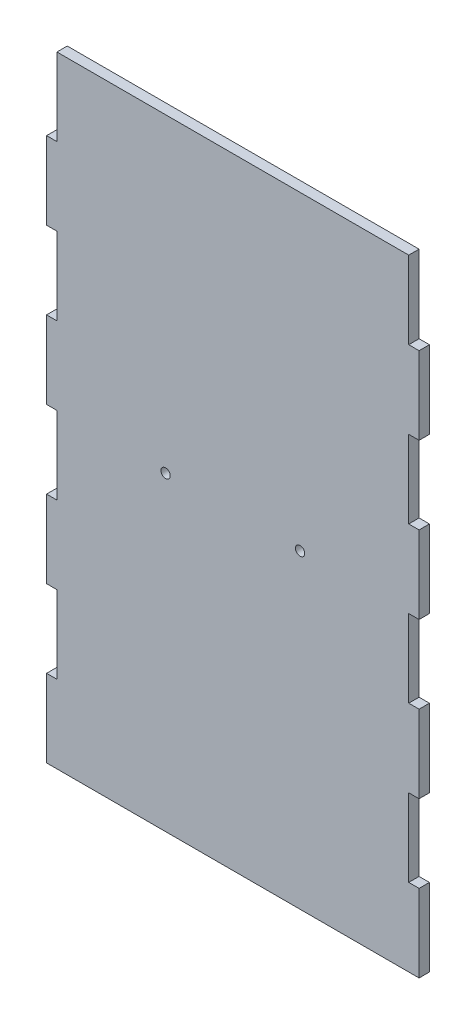
from build123d import *

# Parameters (mm, degrees)
SKETCH1_W           = 180
SKETCH1_H           = 300
SKETCH1_R           = 2.25
BOSS_EXTRUDE1_DEPTH = 5
CUT_EXTRUDE1_REACH  = 315.249
SKETCH2_W           = 5
SKETCH2_H           = 37.5


with BuildPart() as part:
    # Sketch1 → Boss-Extrude1 (new body)
    with BuildSketch(Plane.XY):
        with Locations((0, 150)):
            Rectangle(SKETCH1_W, SKETCH1_H)
        with Locations((-32.5, 150)):
            Circle(SKETCH1_R, mode=Mode.SUBTRACT)
        with Locations((32.5, 150)):
            Circle(SKETCH1_R, mode=Mode.SUBTRACT)
    extrude(amount=BOSS_EXTRUDE1_DEPTH)

    # Sketch2 → Cut-Extrude1 (cut, up to next)
    with BuildSketch(Plane.XY.offset(5), mode=Mode.PRIVATE) as cut_extrude1_sk1:
        with Locations((-87.5, 281.25)):
            Rectangle(SKETCH2_W, SKETCH2_H)
    cut_extrude1_tool1 = extrude(cut_extrude1_sk1.sketch, amount=-CUT_EXTRUDE1_REACH, mode=Mode.PRIVATE) & part.part
    # Sketch2 → Cut-Extrude1 (cut, up to next)
    with BuildSketch(Plane.XY.offset(5), mode=Mode.PRIVATE) as cut_extrude1_sk2:
        with Locations((-87.5, 206.25)):
            Rectangle(SKETCH2_W, SKETCH2_H)
    cut_extrude1_tool2 = extrude(cut_extrude1_sk2.sketch, amount=-CUT_EXTRUDE1_REACH, mode=Mode.PRIVATE) & part.part
    # Sketch2 → Cut-Extrude1 (cut, up to next)
    with BuildSketch(Plane.XY.offset(5), mode=Mode.PRIVATE) as cut_extrude1_sk3:
        with Locations((-87.5, 131.25)):
            Rectangle(SKETCH2_W, SKETCH2_H)
    cut_extrude1_tool3 = extrude(cut_extrude1_sk3.sketch, amount=-CUT_EXTRUDE1_REACH, mode=Mode.PRIVATE) & part.part
    # Sketch2 → Cut-Extrude1 (cut, up to next)
    with BuildSketch(Plane.XY.offset(5), mode=Mode.PRIVATE) as cut_extrude1_sk4:
        with Locations((-87.5, 56.25)):
            Rectangle(SKETCH2_W, SKETCH2_H)
    cut_extrude1_tool4 = extrude(cut_extrude1_sk4.sketch, amount=-CUT_EXTRUDE1_REACH, mode=Mode.PRIVATE) & part.part
    # Sketch2 → Cut-Extrude1 (cut, up to next)
    with BuildSketch(Plane.XY.offset(5), mode=Mode.PRIVATE) as cut_extrude1_sk5:
        with Locations((87.5, 281.25)):
            Rectangle(SKETCH2_W, SKETCH2_H)
    cut_extrude1_tool5 = extrude(cut_extrude1_sk5.sketch, amount=-CUT_EXTRUDE1_REACH, mode=Mode.PRIVATE) & part.part
    # Sketch2 → Cut-Extrude1 (cut, up to next)
    with BuildSketch(Plane.XY.offset(5), mode=Mode.PRIVATE) as cut_extrude1_sk6:
        with Locations((87.5, 206.25)):
            Rectangle(SKETCH2_W, SKETCH2_H)
    cut_extrude1_tool6 = extrude(cut_extrude1_sk6.sketch, amount=-CUT_EXTRUDE1_REACH, mode=Mode.PRIVATE) & part.part
    # Sketch2 → Cut-Extrude1 (cut, up to next)
    with BuildSketch(Plane.XY.offset(5), mode=Mode.PRIVATE) as cut_extrude1_sk7:
        with Locations((87.5, 131.25)):
            Rectangle(SKETCH2_W, SKETCH2_H)
    cut_extrude1_tool7 = extrude(cut_extrude1_sk7.sketch, amount=-CUT_EXTRUDE1_REACH, mode=Mode.PRIVATE) & part.part
    # Sketch2 → Cut-Extrude1 (cut, up to next)
    with BuildSketch(Plane.XY.offset(5), mode=Mode.PRIVATE) as cut_extrude1_sk8:
        with Locations((87.5, 56.25)):
            Rectangle(SKETCH2_W, SKETCH2_H)
    cut_extrude1_tool8 = extrude(cut_extrude1_sk8.sketch, amount=-CUT_EXTRUDE1_REACH, mode=Mode.PRIVATE) & part.part
    add(cut_extrude1_tool1.solids().sort_by_distance((-87.5, 281.25, 5))[0], mode=Mode.SUBTRACT)
    add(cut_extrude1_tool2.solids().sort_by_distance((-87.5, 206.25, 5))[0], mode=Mode.SUBTRACT)
    add(cut_extrude1_tool3.solids().sort_by_distance((-87.5, 131.25, 5))[0], mode=Mode.SUBTRACT)
    add(cut_extrude1_tool4.solids().sort_by_distance((-87.5, 56.25, 5))[0], mode=Mode.SUBTRACT)
    add(cut_extrude1_tool5.solids().sort_by_distance((87.5, 281.25, 5))[0], mode=Mode.SUBTRACT)
    add(cut_extrude1_tool6.solids().sort_by_distance((87.5, 206.25, 5))[0], mode=Mode.SUBTRACT)
    add(cut_extrude1_tool7.solids().sort_by_distance((87.5, 131.25, 5))[0], mode=Mode.SUBTRACT)
    add(cut_extrude1_tool8.solids().sort_by_distance((87.5, 56.25, 5))[0], mode=Mode.SUBTRACT)


solid = part.part
